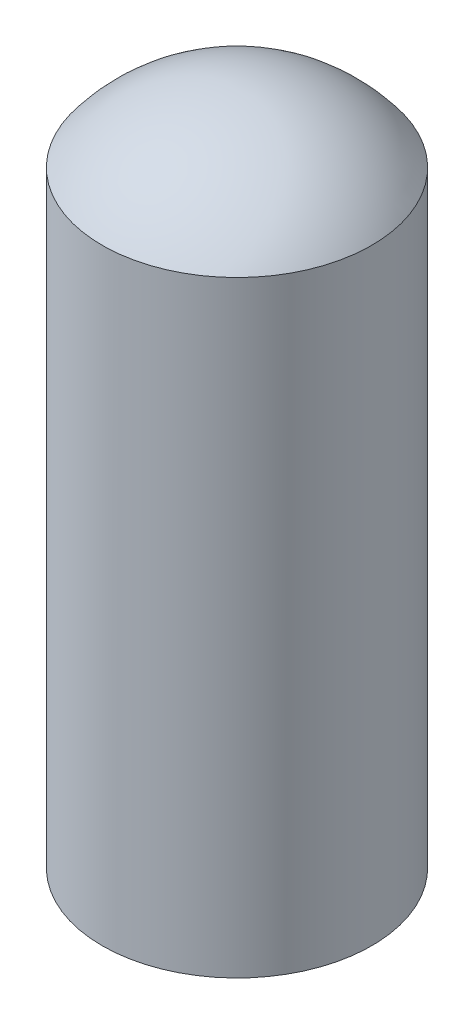
from build123d import *


with BuildPart() as part:
    # Sketch1 → Revolve1 (revolve)
    with BuildSketch(Plane.XY, mode=Mode.PRIVATE) as revolve1_sk:
        with BuildLine():
            Line((0, 0), (-4, 0))
            Line((-4, 0), (-4, 18))
            ThreePointArc((-4, 18), (-2.236067977, 19.472135955), (0, 20))
            Line((0, 20), (0, 0))
        make_face()
    revolve(revolve1_sk.sketch.rotate(Axis((0, 0, 0), (0, 1, 0)), 270), axis=Axis((0, 0, 0), (0, 1, 0)))


solid = part.part
